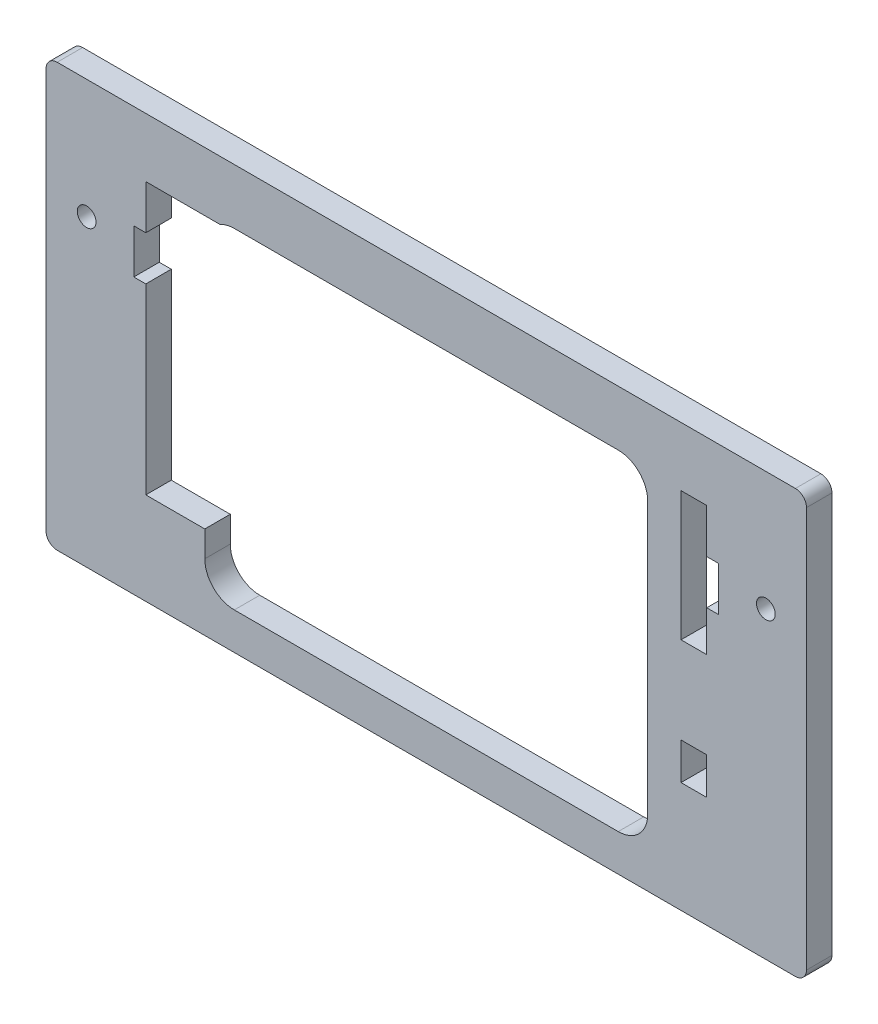
from build123d import *

# Parameters (mm, degrees)
SKETCH1_W           = 206
SKETCH1_H           = 114.5
BOSS_EXTRUDE1_DEPTH = 6.9
SKETCH2_W           = 120
SKETCH2_H           = 88
CUT_EXTRUDE1_DEPTH  = 119.043095944
FILLET1_R           = 8
SKETCH7_R           = 2.54
CUT_EXTRUDE5_DEPTH  = 119.043095944
SKETCH9_W           = 6.96
SKETCH9_H           = 35
SKETCH9_H_2         = 10
CUT_EXTRUDE7_DEPTH  = 119.043095944
SKETCH11_W          = 3.25
SKETCH11_H          = 12
CUT_EXTRUDE8_DEPTH  = 119.043095944
FILLET2_R           = 3
SKETCH8_R           = 1.775
CUT_EXTRUDE6_DEPTH  = 119.043095944
SKETCH10_W          = 6.8
SKETCH10_H          = 3
BOSS_EXTRUDE3_DEPTH = 6.9
FILLET3_R           = 1.5
CUT_EXTRUDE9_DEPTH  = 120.526869364
CUT_EXTRUDE10_DEPTH = 119.043095944
SKETCH15_R          = 1.775
BOSS_EXTRUDE4_DEPTH = 6.9


with BuildPart() as part:
    # Sketch1 → Boss-Extrude1 (new body)
    with BuildSketch(Plane.XY):
        Rectangle(SKETCH1_W, SKETCH1_H)
    extrude(amount=-BOSS_EXTRUDE1_DEPTH)

    # Sketch2 → Cut-Extrude1 (cut, through all)
    with BuildSketch(Plane.XY):
        with Locations((0, -1.75)):
            Rectangle(SKETCH2_W, SKETCH2_H)
    extrude(amount=-CUT_EXTRUDE1_DEPTH, mode=Mode.SUBTRACT)

    # Fillet1
    fillet1_edges = [part.edges().sort_by_distance(p)[0] for p in [
        (-60, -45.75, -3.45),
        (-60, 42.25, -3.45),
        (60, 42.25, -3.45),
        (60, -45.75, -3.45),
    ]]
    fillet(fillet1_edges, radius=FILLET1_R)

    # Sketch7 → Cut-Extrude5 (cut, through all)
    with BuildSketch(Plane.XY):
        with Locations((-92, 25)):
            Circle(SKETCH7_R)
    cut_extrude5 = extrude(amount=-CUT_EXTRUDE5_DEPTH, mode=Mode.SUBTRACT)

    # Sketch9 → Cut-Extrude7 (cut, through all)
    with BuildSketch(Plane.XY):
        with Locations((-72.5, 23.75)):
            Rectangle(SKETCH9_W, SKETCH9_H)
        with Locations((-72.5, -22.25)):
            Rectangle(SKETCH9_W, SKETCH9_H_2)
    cut_extrude7 = extrude(amount=-CUT_EXTRUDE7_DEPTH, mode=Mode.SUBTRACT)

    # Sketch11 → Cut-Extrude8 (cut, through all)
    with BuildSketch(Plane.XY):
        with Locations((-77.605, 23.25)):
            Rectangle(SKETCH11_W, SKETCH11_H)
    cut_extrude8 = extrude(amount=-CUT_EXTRUDE8_DEPTH, mode=Mode.SUBTRACT)

    # Mirror2: Cut-Extrude5, Cut-Extrude7, Cut-Extrude8 across plane
    add(cut_extrude5.mirror(Plane(origin=(0, 0, 0), x_dir=(0, 0, 1), z_dir=(1, 0, 0))), mode=Mode.SUBTRACT)
    add(cut_extrude7.mirror(Plane(origin=(0, 0, 0), x_dir=(0, 0, 1), z_dir=(1, 0, 0))), mode=Mode.SUBTRACT)
    add(cut_extrude8.mirror(Plane(origin=(0, 0, 0), x_dir=(0, 0, 1), z_dir=(1, 0, 0))), mode=Mode.SUBTRACT)

    # Fillet2
    fillet2_edges = [part.edges().sort_by_distance(p)[0] for p in [
        (-103, 57.25, -3.45),
        (103, 57.25, -3.45),
        (103, -57.25, -3.45),
        (-103, -57.25, -3.45),
    ]]
    fillet(fillet2_edges, radius=FILLET2_R)

    # Sketch8 → Cut-Extrude6 (cut, through all)
    with BuildSketch(Plane.XY):
        with Locations((72, -36.75)):
            Circle(SKETCH8_R)
        with Locations((-72, -36.75)):
            Circle(SKETCH8_R)
    extrude(amount=-CUT_EXTRUDE6_DEPTH, mode=Mode.SUBTRACT)

    # Sketch10 → Boss-Extrude3 (add)
    with BuildSketch(Plane.XY):
        with Locations((-38.4, -58.75)):
            Rectangle(SKETCH10_W, SKETCH10_H)
        with Locations((38.4, -58.75)):
            Rectangle(SKETCH10_W, SKETCH10_H)
    extrude(amount=-BOSS_EXTRUDE3_DEPTH)

    # Fillet3
    fillet3_edges = [part.edges().sort_by_distance(p)[0] for p in [
        (-35, -60.25, -3.45),
        (-41.8, -60.25, -3.45),
        (35, -60.25, -3.45),
        (41.8, -60.25, -3.45),
    ]]
    fillet(fillet3_edges, radius=FILLET3_R)

    # Sketch13 → Cut-Extrude9 (cut, through all)
    with BuildSketch(Plane.XY):
        with BuildLine():
            Line((-40.3, -60.25), (-36.5, -60.25))
            ThreePointArc((-36.5, -60.25), (-35.439339828, -59.810660172), (-35, -58.75))
            Line((-35, -58.75), (-35, -57.25))
            Line((-35, -57.25), (-41.8, -57.25))
            Line((-41.8, -57.25), (-41.8, -58.75))
            ThreePointArc((-41.8, -58.75), (-41.360660172, -59.810660172), (-40.3, -60.25))
        make_face()
        with BuildLine():
            Line((35, -57.25), (35, -58.75))
            ThreePointArc((35, -58.75), (35.439339828, -59.810660172), (36.5, -60.25))
            Line((36.5, -60.25), (40.3, -60.25))
            ThreePointArc((40.3, -60.25), (41.360660172, -59.810660172), (41.8, -58.75))
            Line((41.8, -58.75), (41.8, -57.25))
            Line((41.8, -57.25), (35, -57.25))
        make_face()
        with BuildLine():
            Line((-60, -37.75), (-60, -39.25))
            ThreePointArc((-60, -39.25), (-57.656854249, -44.906854249), (-52, -47.25))
            Line((-52, -47.25), (52, -47.25))
            ThreePointArc((52, -47.25), (57.656854249, -44.906854249), (60, -39.25))
            Line((60, -39.25), (60, -37.75))
            ThreePointArc((60, -37.75), (57.656854249, -43.406854249), (52, -45.75))
            Line((52, -45.75), (-52, -45.75))
            ThreePointArc((-52, -45.75), (-57.656854249, -43.406854249), (-60, -37.75))
        make_face()
    extrude(amount=-CUT_EXTRUDE9_DEPTH, mode=Mode.SUBTRACT)

    # Sketch14 → Cut-Extrude10 (cut, through all)
    with BuildSketch(Plane.XY):
        Polygon((-69.02, 6.25), (-75.98, 6.25), (-75.98, -32.25), (-60, -32.25), (-60, 34.25), (-60, 41.25), (-69.02, 41.25), align=None)
        with BuildLine():
            Line((-55.872983346, 41.25), (-60, 41.25))
            Line((-60, 41.25), (-60, 34.25))
            ThreePointArc((-60, 34.25), (-58.891439137, 38.313012013), (-55.872983346, 41.25))
        make_face()
    extrude(amount=-CUT_EXTRUDE10_DEPTH, mode=Mode.SUBTRACT)

    # Sketch15 → Boss-Extrude4 (add)
    with BuildSketch(Plane.XY):
        with Locations((72, -36.75)):
            Circle(SKETCH15_R)
        with Locations((-72, -36.75)):
            Circle(SKETCH15_R)
    extrude(amount=-BOSS_EXTRUDE4_DEPTH)


solid = part.part
